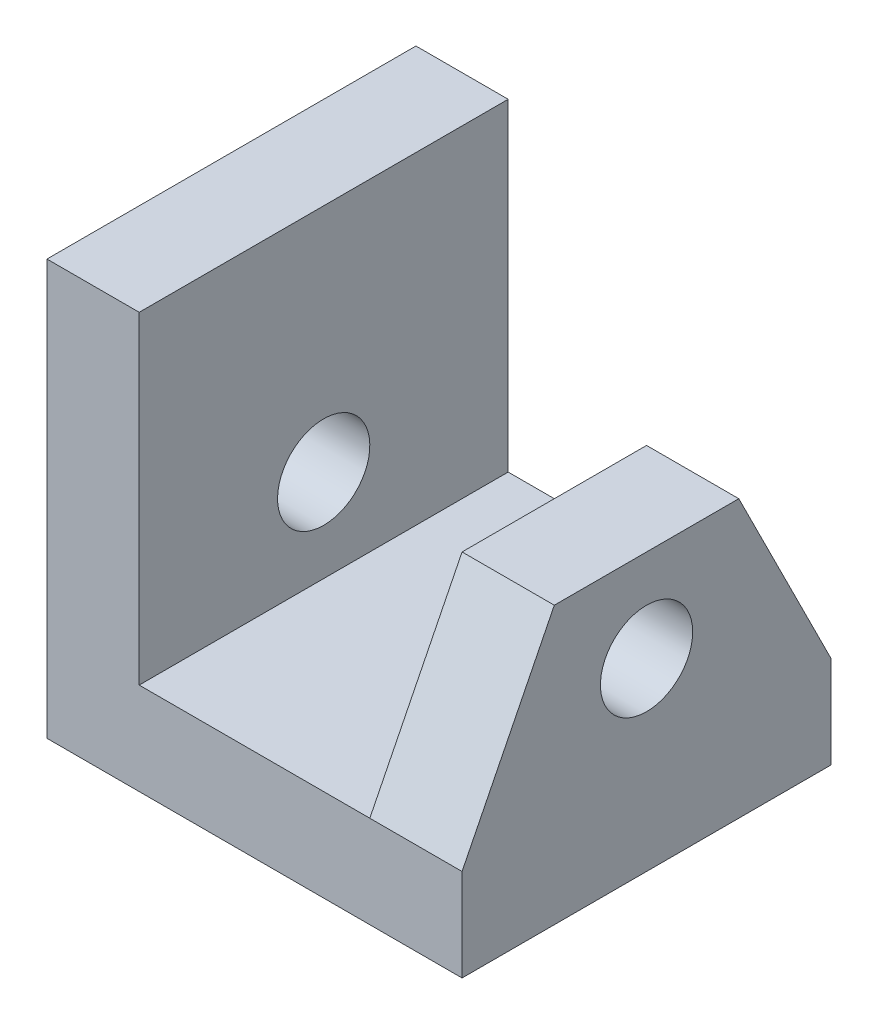
from build123d import *

# Parameters (mm, degrees)
EXTRUDE_1_DEPTH          = 20
SKETCH_1_3_W             = 10
SKETCH_1_3_H             = 20
EXTRUDE_2_DEPTH          = 20
SKETCH_2_R               = 5
CUT_EXTRUDE_1_DEPTH      = 10
CUT_EXTRUDE_2_DEPTH      = 67.708320321
CUT_EXTRUDE_2_DEPTH_BACK = 10
CUT_EXTRUDE_3_DEPTH      = 67.708320321
CUT_EXTRUDE_3_DEPTH_BACK = 10
CUT_EXTRUDE_START        = -10
SKETCH_9_R               = 5
CUT_EXTRUDE_4_DEPTH      = 10


with BuildPart() as part:
    # 스케치1 → 보스-돌출1 (new, symmetric)
    with BuildSketch(Plane.XY):
        Polygon((0, 45), (0, 0), (45, 0), (45, 10), (35, 10), (10, 10), (10, 45), align=None)
    extrude(amount=EXTRUDE_1_DEPTH, both=True)

    # 스케치1<3> → 보스-돌출2 (add, symmetric)
    with BuildSketch(Plane.XY):
        with Locations((40, 20)):
            Rectangle(SKETCH_1_3_W, SKETCH_1_3_H)
    extrude(amount=EXTRUDE_2_DEPTH, both=True)

    # 스케치2 → 컷-돌출1 (cut)
    with BuildSketch(Plane(origin=(45, 0, 0), x_dir=(0, 0, -1), z_dir=(1, 0, 0))):
        with Locations((0, 20)):
            Circle(SKETCH_2_R)
    extrude(amount=-CUT_EXTRUDE_1_DEPTH, mode=Mode.SUBTRACT)

    # 스케치2<5> → 컷-돌출2 (cut, two sides: drawn at the far end of the back side and taken through both)
    with BuildSketch(Plane(origin=(45, 0, 0), x_dir=(0, 0, -1), z_dir=(1, 0, 0)).offset(-CUT_EXTRUDE_2_DEPTH_BACK)):
        Polygon((-20, 10), (-10, 30), (-20, 30), align=None)
    extrude(amount=CUT_EXTRUDE_2_DEPTH + CUT_EXTRUDE_2_DEPTH_BACK, mode=Mode.SUBTRACT)

    # 스케치7 → 컷-돌출3 (cut, two sides: drawn at the far end of the back side and taken through both)
    with BuildSketch(Plane(origin=(45, 0, 0), x_dir=(0, 0, -1), z_dir=(1, 0, 0)).offset(-CUT_EXTRUDE_3_DEPTH_BACK)):
        Polygon((20, 30), (10, 30), (20, 10), align=None)
    extrude(amount=CUT_EXTRUDE_3_DEPTH + CUT_EXTRUDE_3_DEPTH_BACK, mode=Mode.SUBTRACT)

    # 스케치9 → 컷-돌출4 (cut)
    with BuildSketch(Plane.ZY.offset(CUT_EXTRUDE_START)):
        with Locations((0, 20)):
            Circle(SKETCH_9_R)
    extrude(amount=CUT_EXTRUDE_4_DEPTH, mode=Mode.SUBTRACT)


solid = part.part
